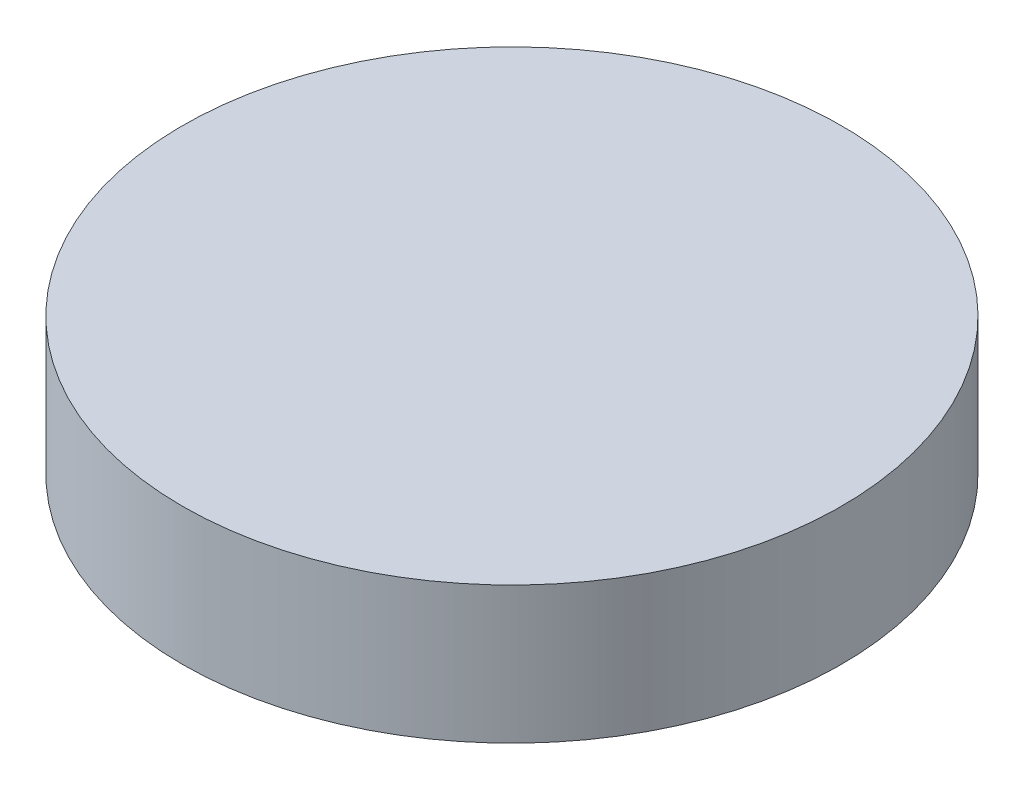
from build123d import *

# Parameters (mm, degrees)
SKETCH1_R           = 16.5
BOSS_EXTRUDE1_DEPTH = 6.858


with BuildPart() as part:
    # Sketch1 → Boss-Extrude1 (new body)
    with BuildSketch(Plane(origin=(0, 0, 0), x_dir=(1, 0, 0), z_dir=(0, 1, 0))):
        with Locations(Location((-0.448384887, 0.617710746, 0), (0, 0, 270))):
            Circle(SKETCH1_R)
    extrude(amount=BOSS_EXTRUDE1_DEPTH)


solid = part.part
